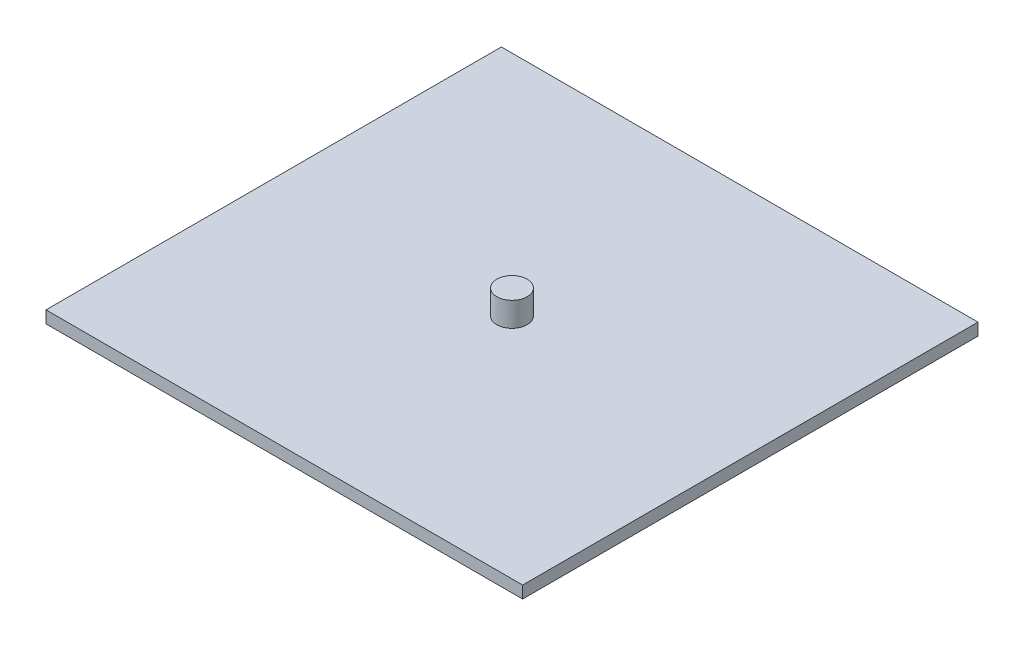
from build123d import *

# Parameters (mm, degrees)
CROQUIS1_W              = 78.5
CROQUIS1_H              = 75
SALIENTE_EXTRUIR1_DEPTH = 2
CROQUIS2_R              = 2.5
SALIENTE_EXTRUIR2_DEPTH = 4


with BuildPart() as part:
    # Croquis1 → Saliente-Extruir1 (new body)
    with BuildSketch(Plane(origin=(0, 0, 0), x_dir=(1, 0, 0), z_dir=(0, 1, 0))):
        Rectangle(CROQUIS1_W, CROQUIS1_H)
    extrude(amount=SALIENTE_EXTRUIR1_DEPTH)

    # Croquis2 → Saliente-Extruir2 (add)
    with BuildSketch(Plane(origin=(0, 2, 0), x_dir=(1, 0, 0), z_dir=(0, 1, 0))):
        with Locations(Location((0, 0, 0), (0, 0, 90))):
            Circle(CROQUIS2_R)
    extrude(amount=SALIENTE_EXTRUIR2_DEPTH)


solid = part.part
